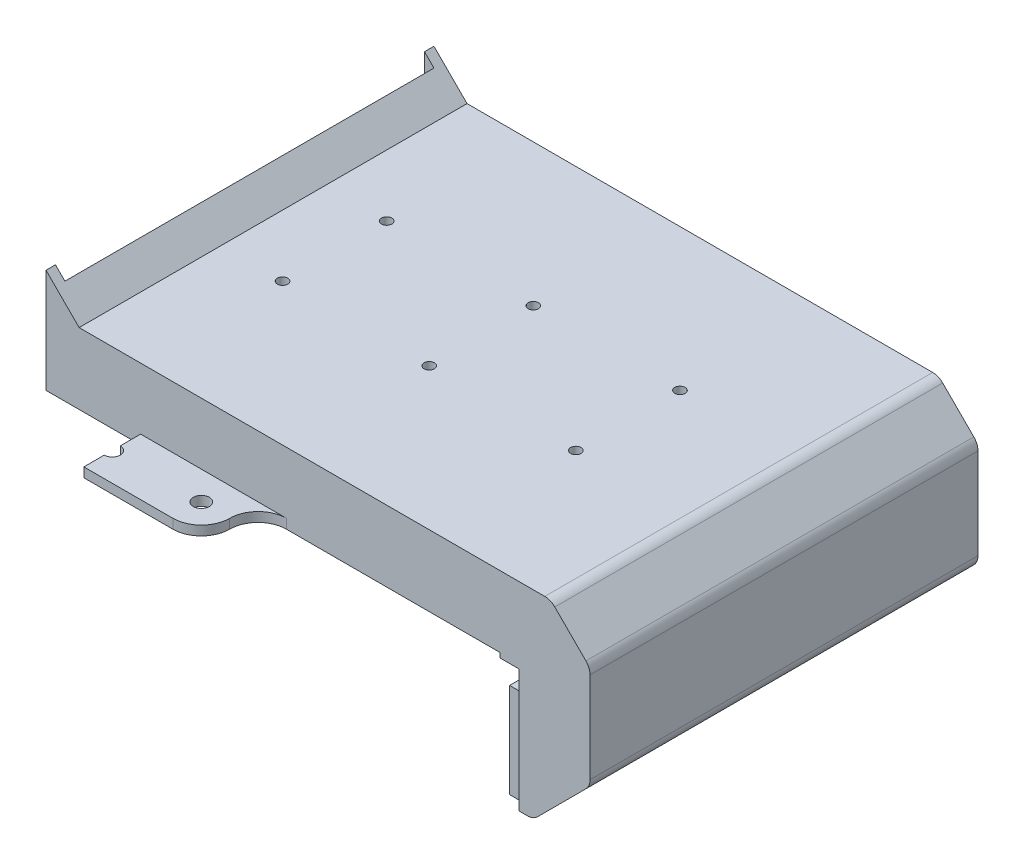
from build123d import *

# Parameters (mm, degrees)
EXTRUDE_1_DEPTH     = 82
FILLET_1_R          = 3
EXTRUDE_START       = -2
EXTRUDE_2_DEPTH     = 2
EXTRUDE_START_2     = -82
EXTRUDE_3_DEPTH     = 2
SKETCH_3_W          = 7
SKETCH_3_H          = 20
EXTRUDE_4_DEPTH     = 2
SKETCH_4_W          = 2
SKETCH_4_H          = 20
EXTRUDE_5_DEPTH     = 1
SKETCH_5_W          = 7
SKETCH_5_H          = 20
EXTRUDE_6_DEPTH     = 2
SKETCH_6_R          = 1.7
EXTRUDE_7_DEPTH     = 2
SKETCH_7_R          = 1.1
CUT_EXTRUDE_1_DEPTH = 2


with BuildPart() as part:
    # 草图1 → 凸台-拉伸1 (new body)
    with BuildSketch(Plane.XY):
        Polygon((0, 2), (3, 2), (13, 12), (13, 33.666666667), (6.666666667, 40), (-93, 40), (-98, 45), (-98, 47), (-93, 42), (6.666666667, 42), (15, 33.666666667), (15, 12), (3, 0), (0, 0), align=None)
    extrude(amount=EXTRUDE_1_DEPTH)

    # 圆角1
    fillet_1_edges = [part.edges().sort_by_distance(p)[0] for p in [
        (3, 2, 41),
        (13, 12, 41),
        (13, 33.666666667, 41),
        (6.666666667, 40, 41),
        (6.666666667, 42, 41),
        (15, 33.666666667, 41),
        (15, 12, 41),
        (3, 0, 41),
    ]]
    fillet(fillet_1_edges, radius=FILLET_1_R)

    # 草图2 → 凸台-拉伸2 (add)
    with BuildSketch(Plane(origin=(0, 0, 0), x_dir=(-1, 0, 0), z_dir=(0, 0, -1)).offset(EXTRUDE_START)):
        with BuildLine():
            Line((100, 27), (100, 49))
            Line((100, 49), (93, 42))
            Line((93, 42), (-5.42402598, 42))
            ThreePointArc((-5.42402598, 42), (-6.572076277, 41.771638598), (-7.545346323, 41.121320344))
            Line((-7.545346323, 41.121320344), (-14.121320344, 34.545346323))
            ThreePointArc((-14.121320344, 34.545346323), (-14.771638598, 33.572076277), (-15, 32.42402598))
            Line((-15, 32.42402598), (-15, 13.242640687))
            ThreePointArc((-15, 13.242640687), (-14.771638598, 12.09459039), (-14.121320344, 11.121320344))
            Line((-14.121320344, 11.121320344), (-3.878679656, 0.878679656))
            ThreePointArc((-3.878679656, 0.878679656), (-2.90540961, 0.228361402), (-1.757359313, 0))
            Line((-1.757359313, 0), (0, 0))
            Line((0, 0), (0, 26))
            Line((0, 26), (4, 26))
            Line((4, 26), (4, 27))
            Line((4, 27), (100, 27))
        make_face()
    extrude(amount=EXTRUDE_2_DEPTH)

    # 草图2<2> → 凸台-拉伸3 (add)
    with BuildSketch(Plane(origin=(0, 0, 0), x_dir=(-1, 0, 0), z_dir=(0, 0, -1)).offset(EXTRUDE_START_2)):
        with BuildLine():
            Line((100, 27), (100, 49))
            Line((100, 49), (93, 42))
            Line((93, 42), (-5.42402598, 42))
            ThreePointArc((-5.42402598, 42), (-6.572076277, 41.771638598), (-7.545346323, 41.121320344))
            Line((-7.545346323, 41.121320344), (-14.121320344, 34.545346323))
            ThreePointArc((-14.121320344, 34.545346323), (-14.771638598, 33.572076277), (-15, 32.42402598))
            Line((-15, 32.42402598), (-15, 13.242640687))
            ThreePointArc((-15, 13.242640687), (-14.771638598, 12.09459039), (-14.121320344, 11.121320344))
            Line((-14.121320344, 11.121320344), (-3.878679656, 0.878679656))
            ThreePointArc((-3.878679656, 0.878679656), (-2.90540961, 0.228361402), (-1.757359313, 0))
            Line((-1.757359313, 0), (0, 0))
            Line((0, 0), (0, 26))
            Line((0, 26), (4, 26))
            Line((4, 26), (4, 27))
            Line((4, 27), (100, 27))
        make_face()
    extrude(amount=EXTRUDE_3_DEPTH)

    # 草图3 → 凸台-拉伸4 (add)
    with BuildSketch(Plane.ZY):
        with Locations((4.5, 11)):
            Rectangle(SKETCH_3_W, SKETCH_3_H)
        with Locations((77.5, 11)):
            Rectangle(SKETCH_3_W, SKETCH_3_H)
    extrude(amount=-EXTRUDE_4_DEPTH)

    # 草图4 → 凸台-拉伸5 (add)
    with BuildSketch(Plane.ZY):
        with Locations((7, 11)):
            Rectangle(SKETCH_4_W, SKETCH_4_H)
        with Locations((75, 11)):
            Rectangle(SKETCH_4_W, SKETCH_4_H)
    extrude(amount=EXTRUDE_5_DEPTH)

    # 草图5 → 凸台-拉伸6 (add)
    with BuildSketch(Plane.ZY.offset(1)):
        with Locations((4.5, 11)):
            Rectangle(SKETCH_5_W, SKETCH_5_H)
        with Locations((77.5, 11)):
            Rectangle(SKETCH_5_W, SKETCH_5_H)
    extrude(amount=EXTRUDE_6_DEPTH)

    # 草图6 → 凸台-拉伸7 (add)
    # profile 1 of 2: a face of its own
    with BuildSketch(Plane.XZ.offset(-27)):
        with BuildLine():
            Line((-80, 86.3), (-80, 82))
            Line((-80, 82), (-49.173938425, 82))
            ThreePointArc((-49.173938425, 82), (-53.416579112, 83.757359313), (-55.173938425, 88))
            ThreePointArc((-55.173938425, 88), (-56.931297738, 92.242640687), (-61.173938425, 94))
            Line((-61.173938425, 94), (-80, 94))
            Line((-80, 94), (-80, 89.7))
            ThreePointArc((-80, 89.7), (-78.3, 88), (-80, 86.3))
        make_face()
        with Locations((-61.173938425, 88)):
            Circle(SKETCH_6_R, mode=Mode.SUBTRACT)
    # profile 2 of 2: a face of its own
    with BuildSketch(Plane.XZ.offset(-27)):
        with BuildLine():
            Line((-80, -12), (-61.173938425, -12))
            ThreePointArc((-61.173938425, -12), (-56.931297738, -10.242640687), (-55.173938425, -6))
            ThreePointArc((-55.173938425, -6), (-53.416579112, -1.757359313), (-49.173938425, 0))
            Line((-49.173938425, 0), (-80, 0))
            Line((-80, 0), (-80, -4.3))
            ThreePointArc((-80, -4.3), (-78.3, -6), (-80, -7.7))
            Line((-80, -7.7), (-80, -12))
        make_face()
        with Locations(Location((-61.173938425, -6, 0), (0, 0, 180))):
            Circle(SKETCH_6_R, mode=Mode.SUBTRACT)
    extrude(amount=-EXTRUDE_7_DEPTH)

    # 草图7 → 切除-拉伸1 (cut)
    with BuildSketch(Plane(origin=(0, 42, 0), x_dir=(1, 0, 0), z_dir=(0, 1, 0))):
        with Locations(Location((-49, -30, 0), (0, 0, 270))):
            Circle(SKETCH_7_R)
        with Locations(Location((-80, -30, 0), (0, 0, 270))):
            Circle(SKETCH_7_R)
        with Locations(Location((-80, -52, 0), (0, 0, 90))):
            Circle(SKETCH_7_R)
        with Locations(Location((-49, -52, 0), (0, 0, 90))):
            Circle(SKETCH_7_R)
        with Locations(Location((-18, -30, 0), (0, 0, 270))):
            Circle(SKETCH_7_R)
        with Locations(Location((-18, -52, 0), (0, 0, 270))):
            Circle(SKETCH_7_R)
    extrude(amount=-CUT_EXTRUDE_1_DEPTH, mode=Mode.SUBTRACT)


solid = part.part
